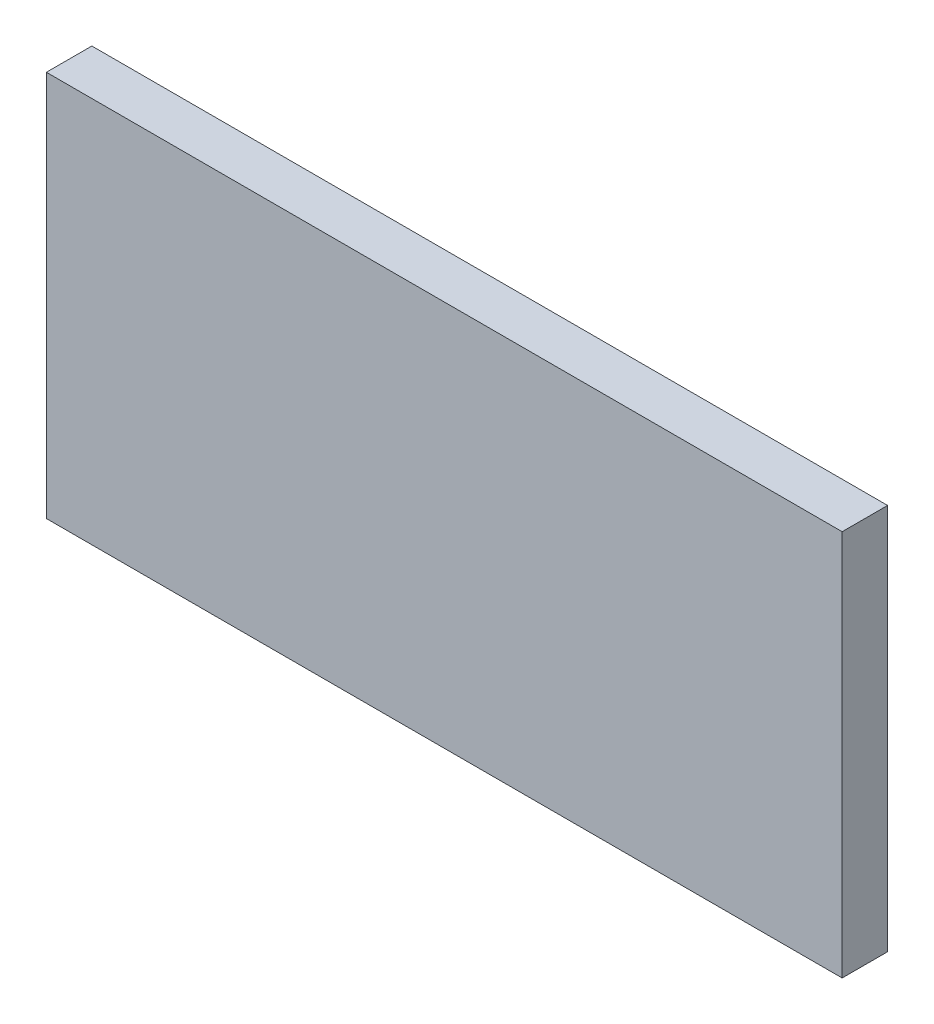
from build123d import *

# Parameters (mm, degrees)
SKETCH_1_W      = 350
SKETCH_1_H      = 170
EXTRUDE_1_DEPTH = 20


with BuildPart() as part:
    # Эскиз1 → Бобышка-Вытянуть1 (new body)
    with BuildSketch(Plane.XY):
        with Locations((175, 85)):
            Rectangle(SKETCH_1_W, SKETCH_1_H)
    extrude(amount=EXTRUDE_1_DEPTH)


solid = part.part
